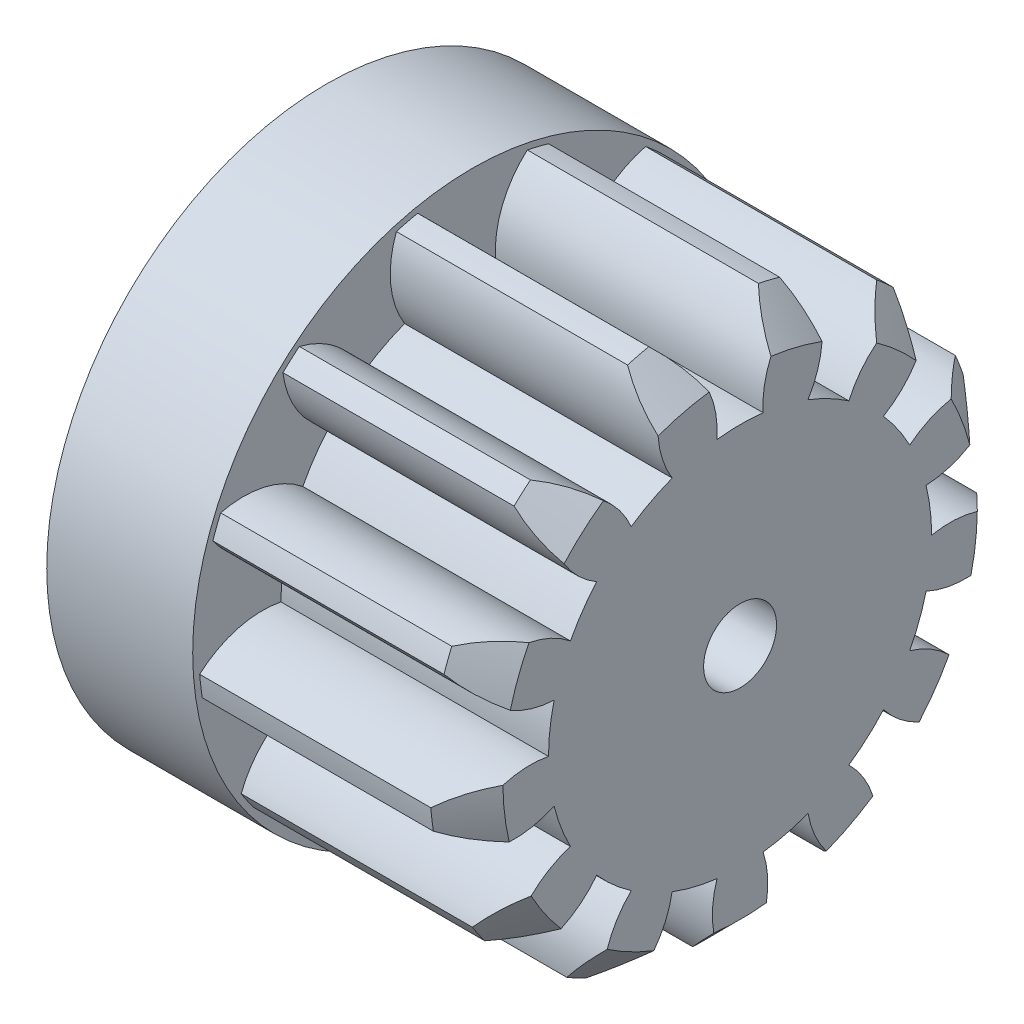
from build123d import *

# Parameters (mm, degrees)
BASPROSKE_W         = 11
BASPROSKE_H         = 11.25
TOOTHCUT_DEPTH      = 20.342311134
TEETHCUTS_COUNT     = 13
TEETHCUTS_ANGLE     = 332.307692308
BORSKE_R            = 1.5
BORE_DEPTH          = 50.0000508
SKETCH2_R           = 11.5
BOSS_EXTRUDE1_DEPTH = 6
SKETCH4_R           = 3.225
CUT_EXTRUDE1_DEPTH  = 3.8
CUT_EXTRUDE2_START  = -6
SKETCH5_R           = 1.5
CUT_EXTRUDE2_DEPTH  = 6
SKETCH6_R           = 1.725
CUT_EXTRUDE3_DEPTH  = 11.8
CUT_EXTRUDE4_DEPTH  = 6.8
CHAMFER1_SIZE       = 1.5


with BuildPart() as part:
    # BasProSke → Base-Revolve (revolve)
    with BuildSketch(Plane(origin=(0, 0, 0), x_dir=(1, 0, 0), z_dir=(0, 1, 0)), mode=Mode.PRIVATE) as base_revolve_sk:
        with Locations((5.5, 5.625)):
            Rectangle(BASPROSKE_W, BASPROSKE_H)
    revolve(base_revolve_sk.sketch.rotate(Axis((-10, 0, 0), (1, 0, 0)), 180), axis=Axis((-10, 0, 0), (1, 0, 0)))

    # TooCutSke → ToothCut (cut, through all)
    with BuildSketch(Plane(origin=(0, 0, 0), x_dir=(0, 0, -1), z_dir=(1, 0, 0))):
        with BuildLine():
            ThreePointArc((0.95135711, 7.81631599), (0, 7.874), (-0.95135711, 7.81631599))
            ThreePointArc((-0.95135711, 7.81631599), (-1.233506032, 9.58619675), (-2.277442519, 11.043002342))
            ThreePointArc((-2.277442519, 11.043002342), (0, 11.2754), (2.277442519, 11.043002342))
            ThreePointArc((2.277442519, 11.043002342), (1.233506032, 9.58619675), (0.95135711, 7.81631599))
        make_face()
    toothcut = extrude(amount=TOOTHCUT_DEPTH, mode=Mode.SUBTRACT)

    # TeethCuts: ToothCut ×13 about axis
    teethcuts_axis = Axis((-10, 0, 0), (1, 0, 0))
    for i in range(1, TEETHCUTS_COUNT):
        add(toothcut.rotate(teethcuts_axis, i * TEETHCUTS_ANGLE / (TEETHCUTS_COUNT - 1)), mode=Mode.SUBTRACT)

    # BorSke → Bore (cut, symmetric)
    with BuildSketch(Plane(origin=(0, 0, 0), x_dir=(0, 0, -1), z_dir=(1, 0, 0))):
        with Locations(Location((0, 0, 0), (0, 0, 180))):
            Circle(BORSKE_R)
    extrude(amount=BORE_DEPTH, both=True, mode=Mode.SUBTRACT)

    # Sketch2 → Boss-Extrude1 (add)
    with BuildSketch(Plane.ZY):
        Circle(SKETCH2_R)
    extrude(amount=BOSS_EXTRUDE1_DEPTH)

    # Sketch4 → Cut-Extrude1 (cut)
    with BuildSketch(Plane.ZY.offset(6)):
        Circle(SKETCH4_R)
    extrude(amount=-CUT_EXTRUDE1_DEPTH, mode=Mode.SUBTRACT)

    # Sketch5 → Cut-Extrude2 (cut)
    with BuildSketch(Plane.ZY.offset(6).offset(CUT_EXTRUDE2_START)):
        Circle(SKETCH5_R)
    extrude(amount=CUT_EXTRUDE2_DEPTH, mode=Mode.SUBTRACT)

    # Sketch6 → Cut-Extrude3 (cut)
    with BuildSketch(Plane(origin=(0, 0, 0), x_dir=(1, 0, 0), z_dir=(0, 1, 0))):
        with Locations(Location((-2.5, 0, 0), (0, 0, 270))):
            Circle(SKETCH6_R)
    extrude(amount=-CUT_EXTRUDE3_DEPTH, mode=Mode.SUBTRACT)

    # Sketch7 → Cut-Extrude4 (cut)
    with BuildSketch(Plane.ZY.offset(6)):
        Polygon((-2.85, -1.370675016), (-2.85, -5.825), (2.85, -5.825), (2.85, -1.370675016), (1.698712748, -1.370675016), (1.698712748, 0), (-1.698712748, 0), (-1.698712748, -1.370675016), align=None)
    extrude(amount=-CUT_EXTRUDE4_DEPTH, mode=Mode.SUBTRACT)

    # Chamfer1
    chamfer1_edges = [part.edges().sort_by_distance(p)[0] for p in [
        (11, -6.390728401, 9.258568491),
        (11, 10.923095446, -2.692301223),
        (11, -9.961380289, 5.228135685),
        (11, -11.25, 0),
        (11, -9.961380289, -5.228135685),
        (11, -6.390728401, -9.258568491),
        (11, -1.356037653, -11.167974834),
        (11, 3.989304979, -10.51893273),
        (11, 8.420745917, -7.460129905),
        (11, 10.923095446, 2.692301223),
        (11, 8.420745917, 7.460129905),
        (11, 3.989304979, 10.51893273),
        (11, -1.356037653, 11.167974834),
    ]]
    chamfer(chamfer1_edges, length=CHAMFER1_SIZE)


solid = part.part
